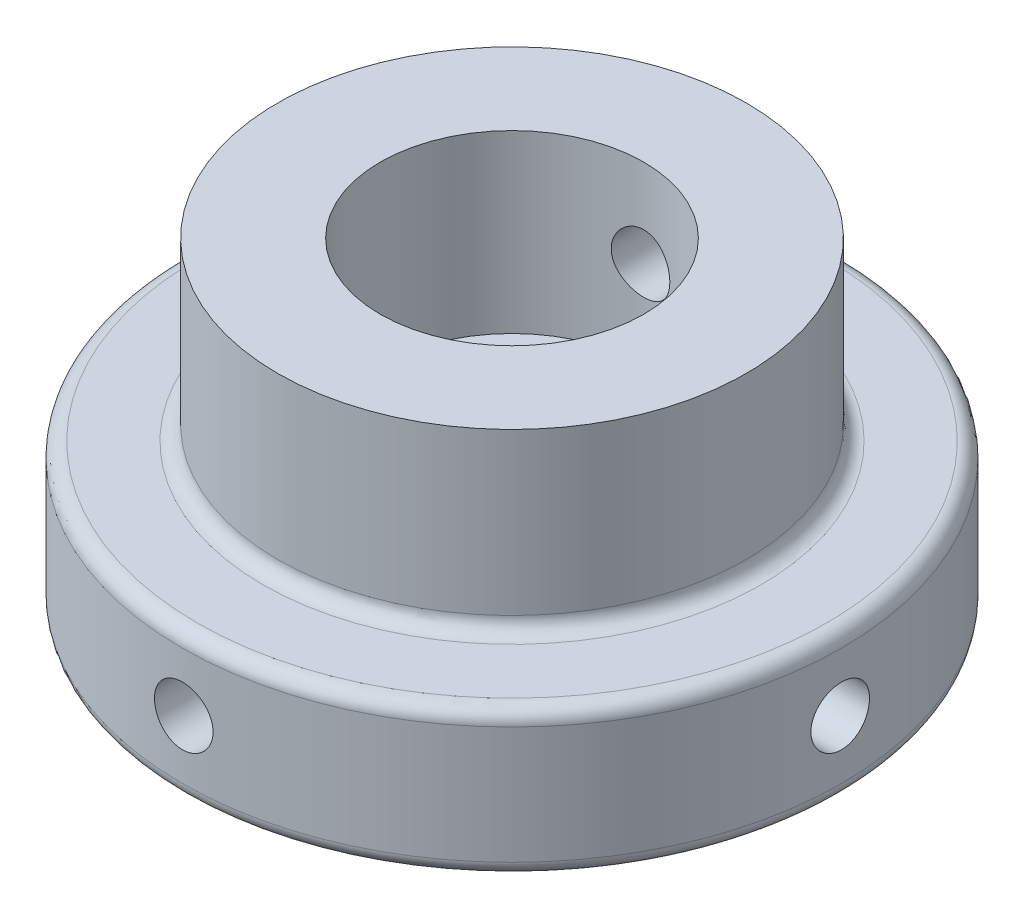
from build123d import *

# Parameters (mm, degrees)
SKETCH1_R           = 32
BOSS_EXTRUDE1_DEPTH = 24
BOSS_EXTRUDE2_START = -20
SKETCH1_4_R         = 45
SKETCH1_4_R_2       = 32
BOSS_EXTRUDE2_DEPTH = 20
SKETCH2_R           = 18
CUT_EXTRUDE1_DEPTH  = 24
CUT_EXTRUDE2_START  = -14
SKETCH3_R           = 4
CUT_EXTRUDE2_DEPTH  = 55.014704293
CIRPATTERN1_COUNT   = 4
SKETCH4_R           = 4
CUT_EXTRUDE3_DEPTH  = 69.014704425
FILLET1_R           = 2


with BuildPart() as part:
    # Sketch1 → Boss-Extrude1 (new body)
    with BuildSketch(Plane(origin=(0, 0, 0), x_dir=(1, 0, 0), z_dir=(0, 1, 0))):
        with Locations(Location((0, 0, 0), (0, 0, 270))):
            Circle(SKETCH1_R)
    extrude(amount=BOSS_EXTRUDE1_DEPTH)

    # Sketch1<4> → Boss-Extrude2 (add)
    # profile 1 of 2: a face of its own
    with BuildSketch(Plane(origin=(0, 0, 0), x_dir=(1, 0, 0), z_dir=(0, 1, 0)).offset(BOSS_EXTRUDE2_START)):
        with Locations(Location((0, 0, 0), (0, 0, 270))):
            Circle(SKETCH1_4_R)
        with Locations(Location((0, 0, 0), (0, 0, 270))):
            Circle(SKETCH1_4_R_2, mode=Mode.SUBTRACT)
    # profile 2 of 2: a face of its own
    with BuildSketch(Plane(origin=(0, 0, 0), x_dir=(1, 0, 0), z_dir=(0, 1, 0)).offset(BOSS_EXTRUDE2_START)):
        with Locations(Location((0, 0, 0), (0, 0, 270))):
            Circle(SKETCH1_4_R_2)
    extrude(amount=BOSS_EXTRUDE2_DEPTH)

    # Sketch2 → Cut-Extrude1 (cut)
    with BuildSketch(Plane(origin=(0, 24, 0), x_dir=(1, 0, 0), z_dir=(0, 1, 0))):
        with Locations(Location((0, 0, 0), (0, 0, 270))):
            Circle(SKETCH2_R)
    extrude(amount=-CUT_EXTRUDE1_DEPTH, mode=Mode.SUBTRACT)

    # Sketch3 → Cut-Extrude2 (cut, through all)
    with BuildSketch(Plane.XY.offset(CUT_EXTRUDE2_START)):
        with Locations((0, -10)):
            Circle(SKETCH3_R)
    cut_extrude2 = extrude(amount=-CUT_EXTRUDE2_DEPTH, mode=Mode.SUBTRACT)

    # CirPattern1: Cut-Extrude2 ×4 about axis
    cirpattern1_axis = Axis((0, 0, 0), (0, 1, 0))
    for i in range(1, CIRPATTERN1_COUNT):
        add(cut_extrude2.rotate(cirpattern1_axis, i * 360 / CIRPATTERN1_COUNT), mode=Mode.SUBTRACT)

    # Sketch4 → Cut-Extrude3 (cut, through all)
    with BuildSketch(Plane.XY):
        with Locations((0, 12)):
            Circle(SKETCH4_R)
    extrude(amount=-CUT_EXTRUDE3_DEPTH, mode=Mode.SUBTRACT)

    # Fillet1
    fillet1_edges = [part.edges().sort_by_distance(p)[0] for p in [
        (0, 0, -32),
        (0, -20, -45),
        (0, 0, -45),
    ]]
    fillet(fillet1_edges, radius=FILLET1_R)


solid = part.part
